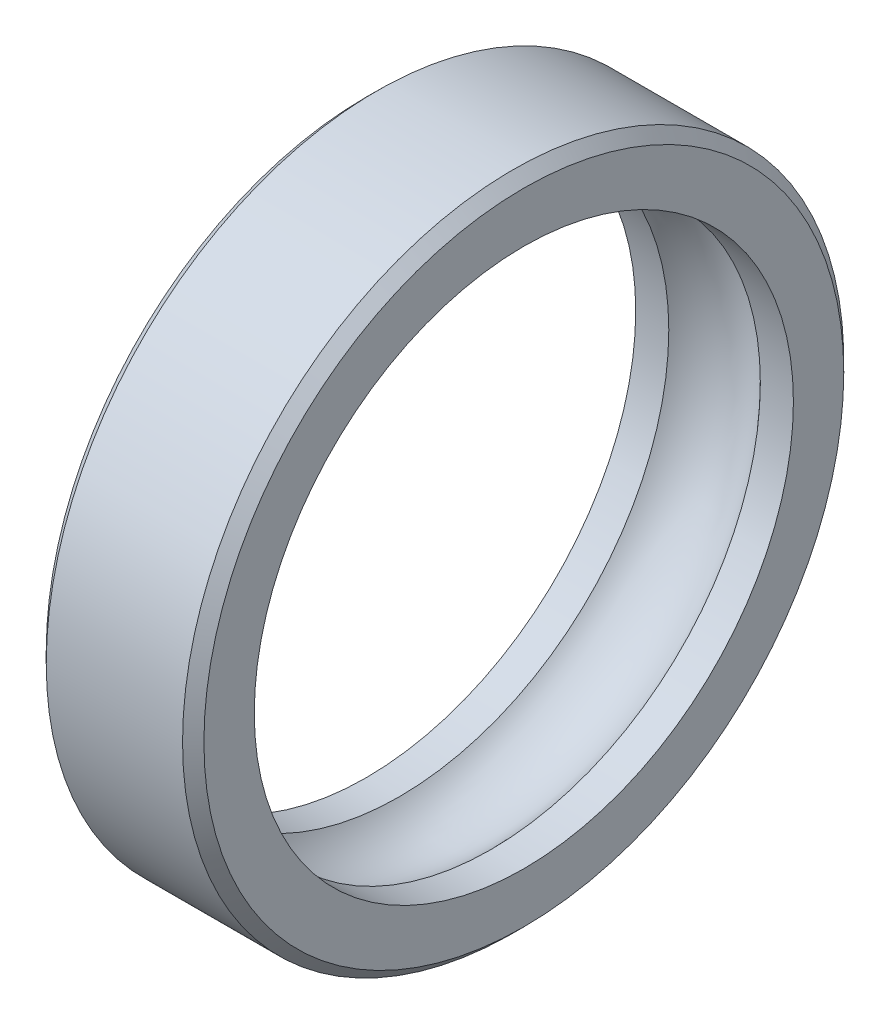
from build123d import *

# Parameters (mm, degrees)
CHAMFER1_SIZE = 2.1


with BuildPart() as part:
    # Sketch1 → Revolve1 (revolve)
    with BuildSketch(Plane.XY, mode=Mode.PRIVATE) as revolve1_sk:
        with BuildLine():
            Line((-15.170481252, 65), (15.829518748, 65))
            Line((15.829518748, 65), (15.829518748, 53))
            Line((15.829518748, 53), (9.329518748, 53))
            ThreePointArc((9.329518748, 53), (0.329518748, 57.062746067), (-8.670481252, 53))
            Line((-8.670481252, 53), (-15.170481252, 53))
            Line((-15.170481252, 53), (-15.170481252, 65))
        make_face()
    revolve(revolve1_sk.sketch.rotate(Axis((-8.519406172, 0, 0), (1, 0, 0)), 90), axis=Axis((-8.519406172, 0, 0), (1, 0, 0)))

    # Chamfer1
    chamfer1_edges = [part.edges().sort_by_distance(p)[0] for p in [
        (15.829518748, 0, -65),
        (-15.170481252, 0, -65),
    ]]
    chamfer(chamfer1_edges, length=CHAMFER1_SIZE)


solid = part.part
